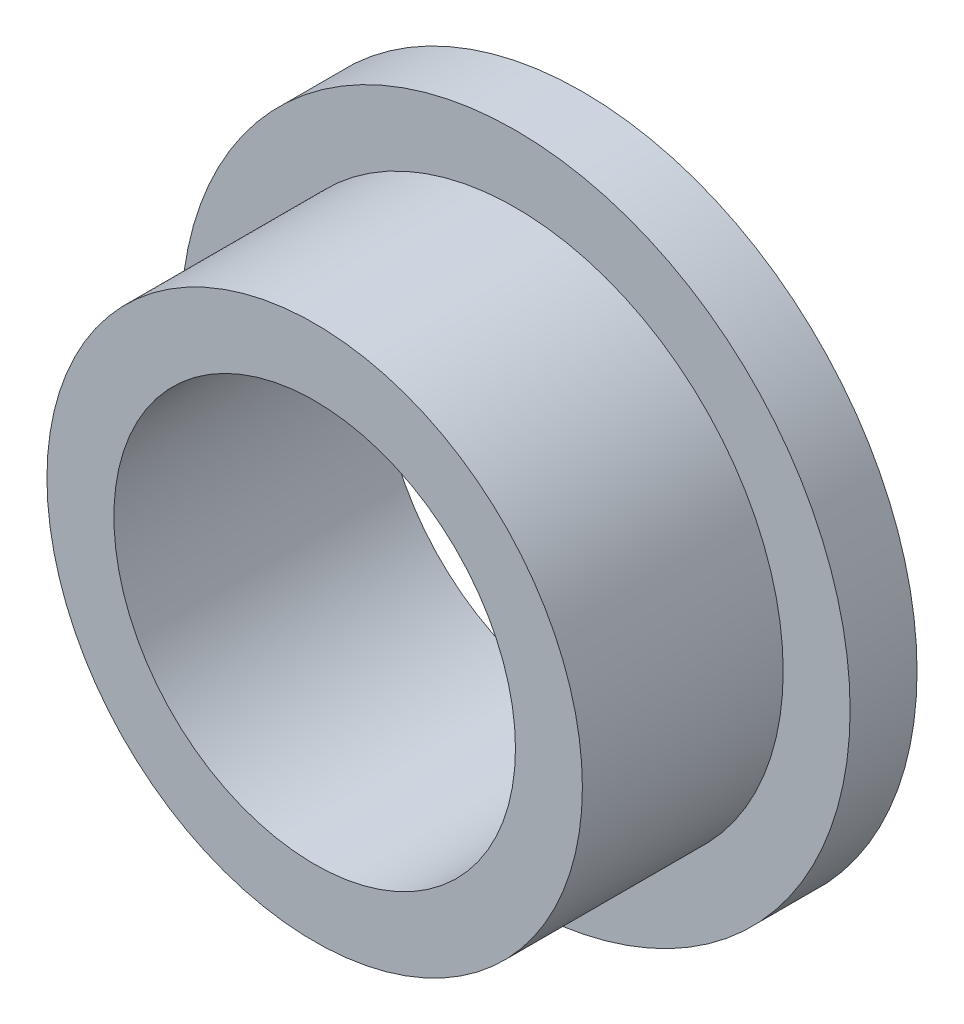
from build123d import *


with BuildPart() as part:
    # 草图1 → 旋转1 (revolve)
    with BuildSketch(Plane(origin=(0, 0, 0), x_dir=(0, 0, -1), z_dir=(1, 0, 0)), mode=Mode.PRIVATE) as revolve_1_sk:
        Polygon((0, 3), (4, 3), (4, 5), (3, 5), (3, 4), (0, 4), align=None)
    revolve(revolve_1_sk.sketch.rotate(Axis((0, 0, 0), (0, 0, -1)), 90), axis=Axis((0, 0, 0), (0, 0, -1)))


solid = part.part
